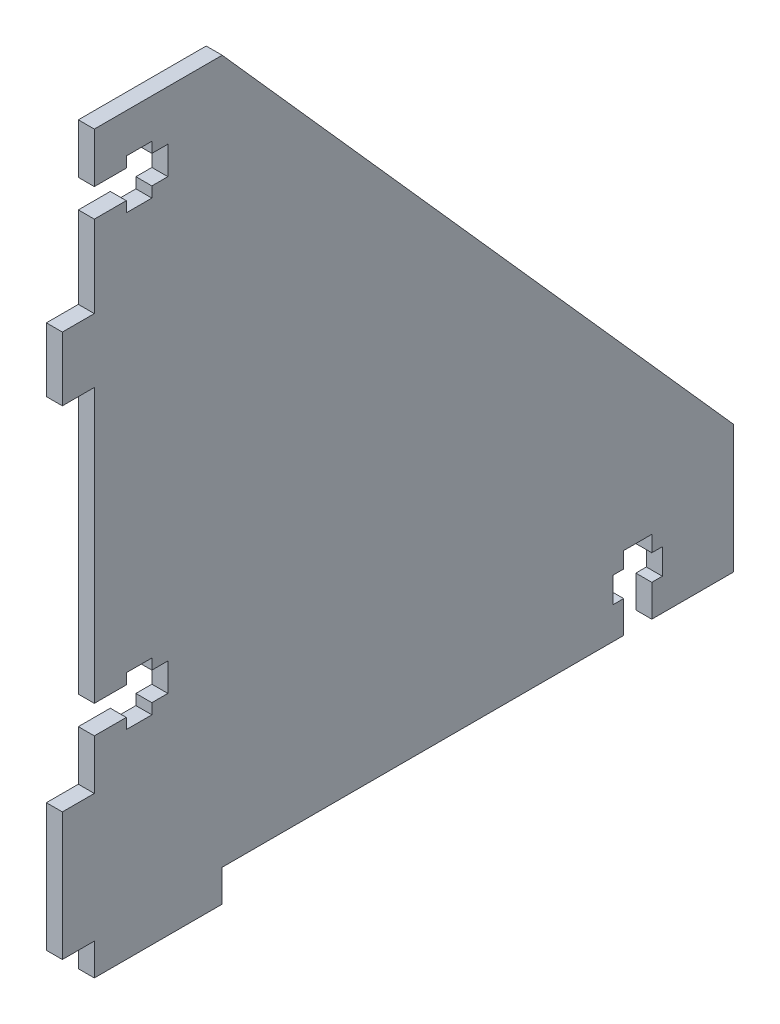
from build123d import *

# Parameters (mm, degrees)
BOSS_EXTRUDE1_DEPTH = 2.5


with BuildPart() as part:
    # Sketch1 → Boss-Extrude1 (new body)
    with BuildSketch(Plane(origin=(0, 0, 0), x_dir=(0, 0, -1), z_dir=(1, 0, 0))):
        Polygon((100, 20), (20, 110), (0, 110), (0, 102.2), (5, 102.2), (5, 103.85), (9, 103.85), (9, 102.2), (11.5, 102.2), (11.5, 97.8), (9, 97.8), (9, 96.15), (5, 96.15), (5, 97.8), (0, 97.8), (0, 85), (-5, 85), (-5, 75), (0, 75), (0, 32.2), (5, 32.2), (5, 33.85), (9, 33.85), (9, 32.2), (11.5, 32.2), (11.5, 27.8), (9, 27.8), (9, 26.15), (5, 26.15), (5, 27.8), (0, 27.8), (0, 20), (-5, 20), (-5, 0), (0, 0), (0, -5), (20, -5), (20, 0), (82.8, 0), (82.8, 5), (81.15, 5), (81.15, 9), (82.8, 9), (82.8, 11.5), (87.2, 11.5), (87.2, 9), (88.85, 9), (88.85, 5), (87.2, 5), (87.2, 0), (100, 0), align=None)
    extrude(amount=BOSS_EXTRUDE1_DEPTH)


solid = part.part
